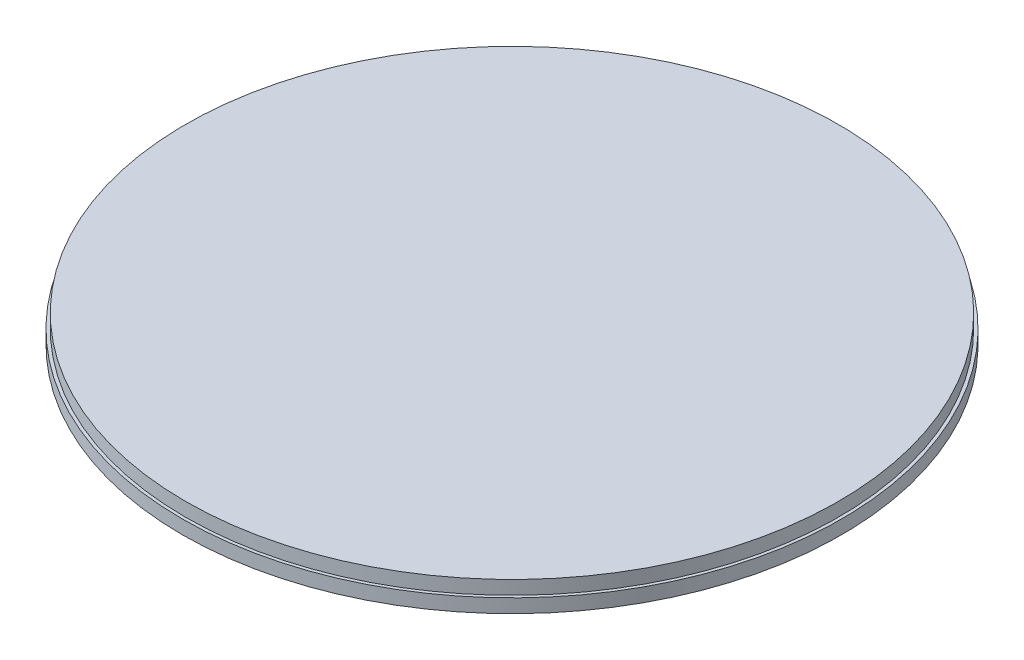
from build123d import *

# Parameters (mm, degrees)
SKETCH1_R           = 76.2
BOSS_EXTRUDE1_DEPTH = 3.175
SKETCH2_R           = 75.4888
BOSS_EXTRUDE2_DEPTH = 3.175


with BuildPart() as part:
    # Sketch1 → Boss-Extrude1 (new body)
    with BuildSketch(Plane(origin=(0, 0, 0), x_dir=(1, 0, 0), z_dir=(0, 1, 0))):
        with Locations(Location((0, 0, 0), (0, 0, 270))):
            Circle(SKETCH1_R)
    extrude(amount=BOSS_EXTRUDE1_DEPTH)

    # Sketch2 → Boss-Extrude2 (add)
    with BuildSketch(Plane(origin=(0, 3.175, 0), x_dir=(1, 0, 0), z_dir=(0, 1, 0))):
        with Locations(Location((0, 0, 0), (0, 0, 270))):
            Circle(SKETCH2_R)
    extrude(amount=BOSS_EXTRUDE2_DEPTH)


solid = part.part
